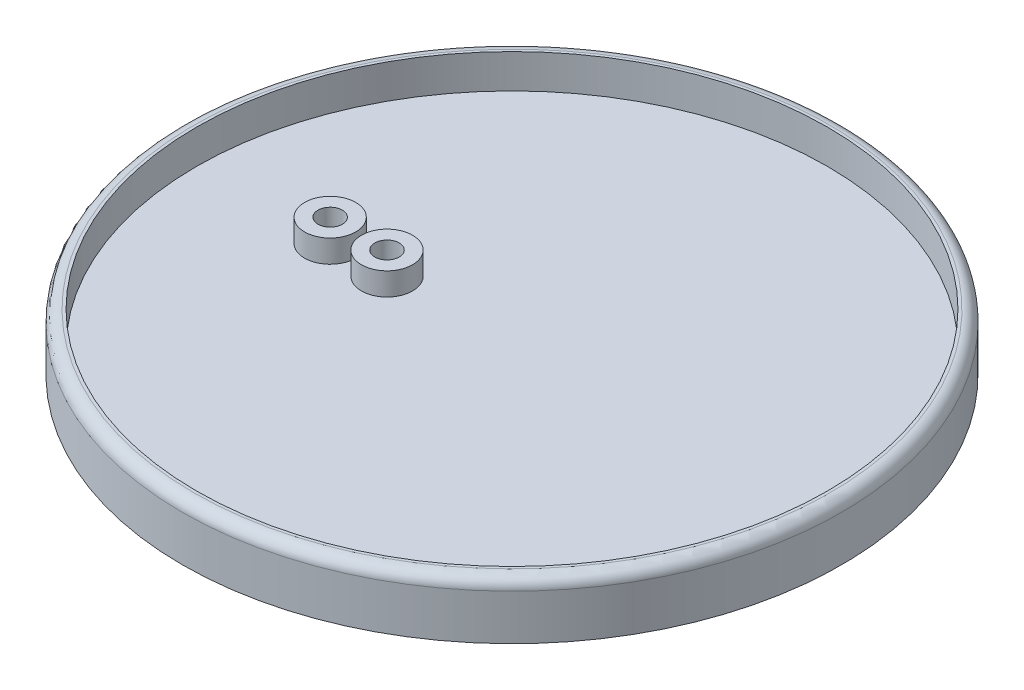
from build123d import *

# Parameters (mm, degrees)
SKETCH_1_R                       = 4.5
MOVING_POST_A_DEPTH              = 8
SKETCH_2_R                       = 58
CUP_PLATE_D116_T4_DEPTH          = 4
SKETCH_3_R                       = 4.5
MOVING_POST_B_DEPTH              = 8
SKETCH_4_R                       = 58
SKETCH_4_R_2                     = 55.5
DRIP_SKIRT_OD116_ID111_H10_DEPTH = 10
SKETCH_5_R                       = 2.15
M4_MOVING_MOUNT_CLEARANCE_DEPTH  = 8
CUP_TOP_OUTER_ROUND_R2_R         = 2


with BuildPart() as part:
    # 草图1 → Moving_post_A (new body)
    with BuildSketch(Plane(origin=(0, 0, 0), x_dir=(1, 0, 0), z_dir=(0, 1, 0))):
        with Locations(Location((-22, 0, 0), (0, 0, 270))):
            Circle(SKETCH_1_R)
    extrude(amount=MOVING_POST_A_DEPTH)

    # 草图2 → Cup_plate_D116_T4 (add)
    with BuildSketch(Plane(origin=(0, 0, 0), x_dir=(1, 0, 0), z_dir=(0, 1, 0))):
        with Locations(Location((0, 0, 0), (0, 0, 270))):
            Circle(SKETCH_2_R)
    extrude(amount=CUP_PLATE_D116_T4_DEPTH)

    # 草图3 → Moving_post_B (add)
    with BuildSketch(Plane(origin=(0, 0, 0), x_dir=(1, 0, 0), z_dir=(0, 1, 0))):
        with Locations(Location((-32, 0, 0), (0, 0, 270))):
            Circle(SKETCH_3_R)
    extrude(amount=MOVING_POST_B_DEPTH)

    # 草图4 → Drip_skirt_OD116_ID111_H10 (add)
    with BuildSketch(Plane(origin=(0, 0, 0), x_dir=(1, 0, 0), z_dir=(0, 1, 0))):
        with Locations(Location((0, 0, 0), (0, 0, 270))):
            Circle(SKETCH_4_R)
        with Locations(Location((0, 0, 0), (0, 0, 270))):
            Circle(SKETCH_4_R_2, mode=Mode.SUBTRACT)
    extrude(amount=DRIP_SKIRT_OD116_ID111_H10_DEPTH)

    # 草图5 → M4_moving_mount_clearance (cut)
    with BuildSketch(Plane(origin=(0, 0, 0), x_dir=(1, 0, 0), z_dir=(0, 1, 0))):
        with Locations(Location((-22, 0, 0), (0, 0, 270))):
            Circle(SKETCH_5_R)
        with Locations(Location((-32, 0, 0), (0, 0, 270))):
            Circle(SKETCH_5_R)
    extrude(amount=M4_MOVING_MOUNT_CLEARANCE_DEPTH, mode=Mode.SUBTRACT)

    # Cup_top_outer_round_R2
    cup_top_outer_round_r2_edges = [part.edges().sort_by_distance(p)[0] for p in [
        (0, 10, -58),
    ]]
    fillet(cup_top_outer_round_r2_edges, radius=CUP_TOP_OUTER_ROUND_R2_R)


solid = part.part
